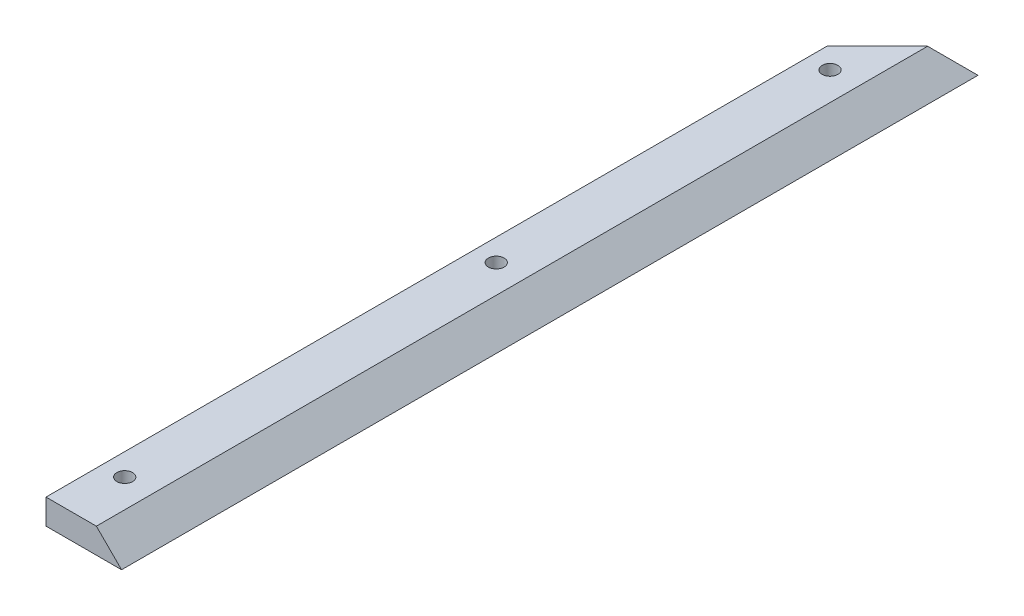
from build123d import *

# Parameters (mm, degrees)
BOSS_EXTRUDE1_DEPTH            = 215.9
CUT_EXTRUDE1_DEPTH             = 218.110576665
F_5_16_0_3125_DIAMETER_HOLE1_D = 7.9375


with BuildPart() as part:
    # Sketch1 → Boss-Extrude1 (new, symmetric)
    with BuildSketch(Plane.XY):
        Polygon((19.05, -6.35), (6.35, 6.35), (-19.05, 6.35), (-19.05, -6.35), align=None)
    extrude(amount=BOSS_EXTRUDE1_DEPTH, both=True)

    # Sketch2 → Cut-Extrude1 (cut, through all)
    with BuildSketch(Plane(origin=(0, 6.35, 0), x_dir=(1, 0, 0), z_dir=(0, 1, 0))):
        Polygon((-19.05, 215.9), (19.05, 215.9), (-19.05, 177.8), align=None)
    extrude(amount=-CUT_EXTRUDE1_DEPTH, mode=Mode.SUBTRACT)

    # 5/16 (0.3125) Diameter Hole1 (through all)
    with Locations(Plane(origin=(0, 6.35, 0), x_dir=(1, 0, 0), z_dir=(0, 1, 0))):
        with Locations((-7.9375, -187.325), (-7.9375, 0), (-7.9375, 168.275)):
            Hole(F_5_16_0_3125_DIAMETER_HOLE1_D / 2)


solid = part.part
